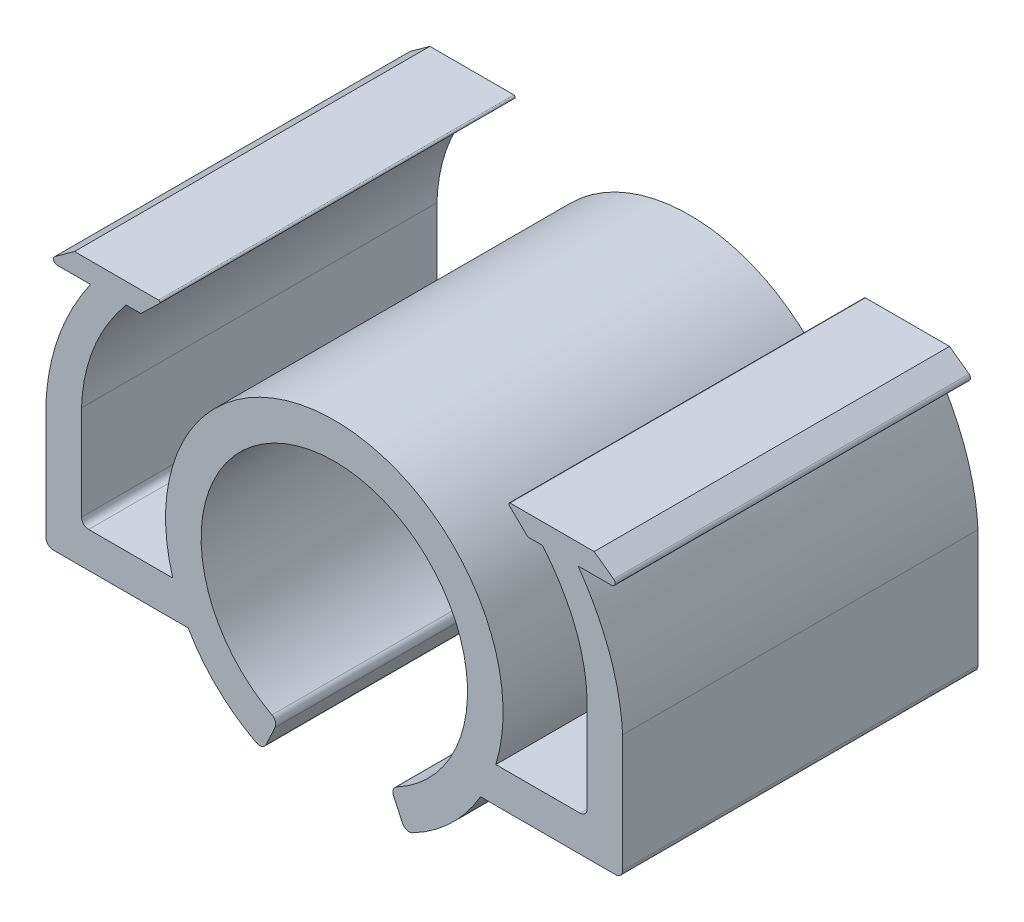
from build123d import *

# Parameters (mm, degrees)
BOSS_EXTRUDE1_DEPTH = 12.7


with BuildPart() as part:
    # Sketch2 → Boss-Extrude1 (new body)
    with BuildSketch(Plane.XY):
        with BuildLine():
            ThreePointArc((5.773500374, -1.742289015), (0, 6.030661454), (-5.773500374, -1.742289015))
            Line((-5.773500374, -1.742289015), (-8.780460974, -1.742289015))
            ThreePointArc((-8.780460974, -1.742289015), (-8.960066096, -1.667894137), (-9.034460974, -1.488289015))
            Line((-9.034460974, -1.488289015), (-9.034460974, 1.893843998))
            add(Edge.make_bspline(
                [(-7.444124292, 5.87424347), (-8.965547881, 4.023759), (-9.034460974, 1.893843998)],
                knots=[0, 0, 0, 0.913335216, 0.913335216, 0.913335216], degree=2))
            Line((-7.444124292, 5.87424347), (-6.936124292, 5.87424347))
            ThreePointArc((-6.936124292, 5.87424347), (-6.917046287, 5.877961948), (-6.90076124, 5.888573008))
            Line((-6.90076124, 5.888573008), (-6.249346457, 6.52020785))
            ThreePointArc((-6.249346457, 6.52020785), (-6.237627986, 6.575756317), (-6.284709509, 6.607478312))
            Line((-6.284709509, 6.607478312), (-9.286536111, 6.607478312))
            Line((-9.286536111, 6.607478312), (-9.983863182, 6.104225847))
            ThreePointArc((-9.983863182, 6.104225847), (-10.030388572, 5.962190697), (-9.909542054, 5.87424347))
            Line((-9.909542054, 5.87424347), (-8.714124292, 5.87424347))
            add(Edge.make_bspline(
                [(-8.714124292, 5.87424347), (-10.178770924, 3.775549962), (-10.304460974, 1.443821028)],
                knots=[0, 0, 0, 0.841932778, 0.841932778, 0.841932778], degree=2))
            Line((-10.304460974, 1.443821028), (-10.304460974, -2.758289015))
            ThreePointArc((-10.304460974, -2.758289015), (-10.230066096, -2.937894137), (-10.050460974, -3.012289015))
            Line((-10.050460974, -3.012289015), (-5.224460974, -3.012289015))
            ThreePointArc((-5.224460974, -3.012289015), (-4.172972974, -4.353754028), (-2.788146807, -5.347440038))
            ThreePointArc((-2.788146807, -5.347440038), (-2.587836882, -5.362863945), (-2.438222108, -5.228784184))
            Line((-2.438222108, -5.228784184), (-2.117239548, -4.540434863))
            ThreePointArc((-2.117239548, -4.540434863), (-2.106552792, -4.351089815), (-2.22923648, -4.206471467))
            ThreePointArc((-2.22923648, -4.206471467), (0, 4.760661454), (2.22923648, -4.206471467))
            ThreePointArc((2.22923648, -4.206471467), (2.106552792, -4.351089815), (2.117239548, -4.540434863))
            Line((2.117239548, -4.540434863), (2.438222108, -5.228784184))
            ThreePointArc((2.438222108, -5.228784184), (2.587836882, -5.362863945), (2.788146807, -5.347440038))
            ThreePointArc((2.788146807, -5.347440038), (4.172972974, -4.353754028), (5.224460974, -3.012289015))
            Line((5.224460974, -3.012289015), (10.050460974, -3.012289015))
            ThreePointArc((10.050460974, -3.012289015), (10.230066096, -2.937894137), (10.304460974, -2.758289015))
            Line((10.304460974, -2.758289015), (10.304460974, 1.443821028))
            add(Edge.make_bspline(
                [(8.714124292, 5.87424347), (10.178770924, 3.775549962), (10.304460974, 1.443821028)],
                knots=[0, 0, 0, 0.841932778, 0.841932778, 0.841932778], degree=2))
            Line((8.714124292, 5.87424347), (9.909542054, 5.87424347))
            ThreePointArc((9.909542054, 5.87424347), (10.030388572, 5.962190697), (9.983863182, 6.104225847))
            Line((9.983863182, 6.104225847), (9.286536111, 6.607478312))
            Line((9.286536111, 6.607478312), (6.284709509, 6.607478312))
            ThreePointArc((6.284709509, 6.607478312), (6.237627986, 6.575756317), (6.249346457, 6.52020785))
            Line((6.249346457, 6.52020785), (6.90076124, 5.888573008))
            ThreePointArc((6.90076124, 5.888573008), (6.917046287, 5.877961948), (6.936124292, 5.87424347))
            Line((6.936124292, 5.87424347), (7.444124292, 5.87424347))
            add(Edge.make_bspline(
                [(7.444124292, 5.87424347), (8.965547881, 4.023759), (9.034460974, 1.893843998)],
                knots=[0, 0, 0, 0.913335216, 0.913335216, 0.913335216], degree=2))
            Line((9.034460974, 1.893843998), (9.034460974, -1.488289015))
            ThreePointArc((9.034460974, -1.488289015), (8.960066096, -1.667894137), (8.780460974, -1.742289015))
            Line((8.780460974, -1.742289015), (5.773500374, -1.742289015))
        make_face()
    extrude(amount=BOSS_EXTRUDE1_DEPTH)


solid = part.part
